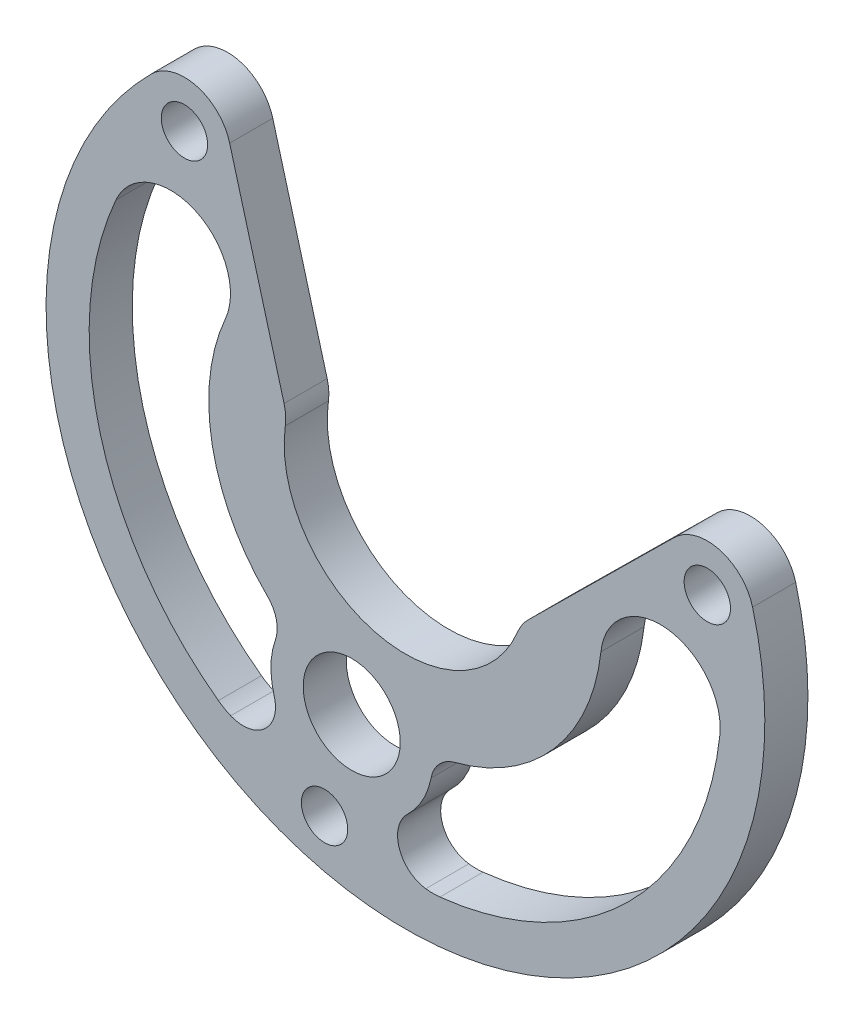
from build123d import *

# Parameters (mm, degrees)
SKETCH1_R           = 2.15
BOSS_EXTRUDE1_DEPTH = 4
SKETCH2_R           = 4.5
CUT_EXTRUDE1_DEPTH  = 10
BOSS_EXTRUDE2_START = -4
SKETCH3_R           = 7.5
SKETCH3_R_2         = 4.5
BOSS_EXTRUDE2_DEPTH = 4
FILLET1_R           = 3


with BuildPart() as part:
    # Sketch1 → Boss-Extrude1 (new body)
    with BuildSketch(Plane.XY):
        with BuildLine():
            Line((169.071208826, 34.599951739), (155.49789847, 21.187541922))
            ThreePointArc((155.49789847, 21.187541922), (154.94043739, 20.512931345), (154.52928773, 19.740391219))
            ThreePointArc((154.52928773, 19.740391219), (141.205165824, 13.133334454), (132.969666153, 25.51727441))
            ThreePointArc((132.969666153, 25.51727441), (132.999870165, 26.391888614), (132.854399997, 27.254849052))
            Line((132.854399997, 27.254849052), (127.805773323, 45.656991858))
            ThreePointArc((127.805773323, 45.656991858), (124.72411503, 48.711211723), (120.534868929, 47.582011153))
            ThreePointArc((120.534868929, 47.582011153), (135.485264927, -8.213626307), (176.330506388, 32.631615154))
            ThreePointArc((176.330506388, 32.631615154), (173.267113127, 35.704154585), (169.071208826, 34.599951739))
        make_face()
        with Locations((123.610783427, 44.506096654)):
            Circle(SKETCH1_R, mode=Mode.SUBTRACT)
        with Locations((172.128729044, 31.505752308)):
            Circle(SKETCH1_R, mode=Mode.SUBTRACT)
        with Locations((136.611127773, -4.011848962)):
            Circle(SKETCH1_R, mode=Mode.SUBTRACT)
        with BuildLine():
            ThreePointArc((127.410923425, 31.346666741), (124.564673615, 38.661300157), (117.250040198, 35.815050347))
            ThreePointArc((117.250040198, 35.815050347), (115.76695708, 16.403661026), (126.757039397, 0.334446311))
            ThreePointArc((126.757039397, 0.334446311), (134.51482266, 1.526838378), (133.322430592, 9.284621641))
            ThreePointArc((133.322430592, 9.284621641), (126.488733751, 19.276552427), (127.410923425, 31.346666741))
        make_face(mode=Mode.SUBTRACT)
        with BuildLine():
            ThreePointArc((173.291771113, 20.798713806), (168.38023766, 26.920955155), (162.25799631, 22.009421702))
            ThreePointArc((162.25799631, 22.009421702), (157.021578838, 11.095301243), (146.107458379, 5.858883771))
            ThreePointArc((146.107458379, 5.858883771), (141.195924926, -0.263357578), (147.318166275, -5.174891032))
            ThreePointArc((147.318166275, -5.174891032), (164.870464109, 3.246415972), (173.291771113, 20.798713806))
        make_face(mode=Mode.SUBTRACT)
    extrude(amount=BOSS_EXTRUDE1_DEPTH)

    # Sketch2 → Cut-Extrude1 (cut)
    with BuildSketch(Plane(origin=(0, 0, 0), x_dir=(-1, 0, 0), z_dir=(0, 0, -1))):
        with Locations((-139.134613463, 5.405927844)):
            Circle(SKETCH2_R)
    extrude(amount=-CUT_EXTRUDE1_DEPTH, mode=Mode.SUBTRACT)

    # Sketch3 → Boss-Extrude2 (add)
    with BuildSketch(Plane.XY.offset(4).offset(BOSS_EXTRUDE2_START)):
        with Locations((139.134613463, 5.405927844)):
            Circle(SKETCH3_R)
        with Locations(Location((139.134613463, 5.405927844, 0), (0, 0, 180))):
            Circle(SKETCH3_R_2, mode=Mode.SUBTRACT)
    extrude(amount=BOSS_EXTRUDE2_DEPTH)

    # Fillet1
    fillet1_edges = [part.edges().sort_by_distance(p)[0] for p in [
        (133.49265497, 0.464439772, 2),
        (141.549948809, -1.694505605, 2),
        (146.616834445, 5.922037499, 2),
        (132.912874843, 9.594002408, 2),
    ]]
    fillet(fillet1_edges, radius=FILLET1_R)


solid = part.part
